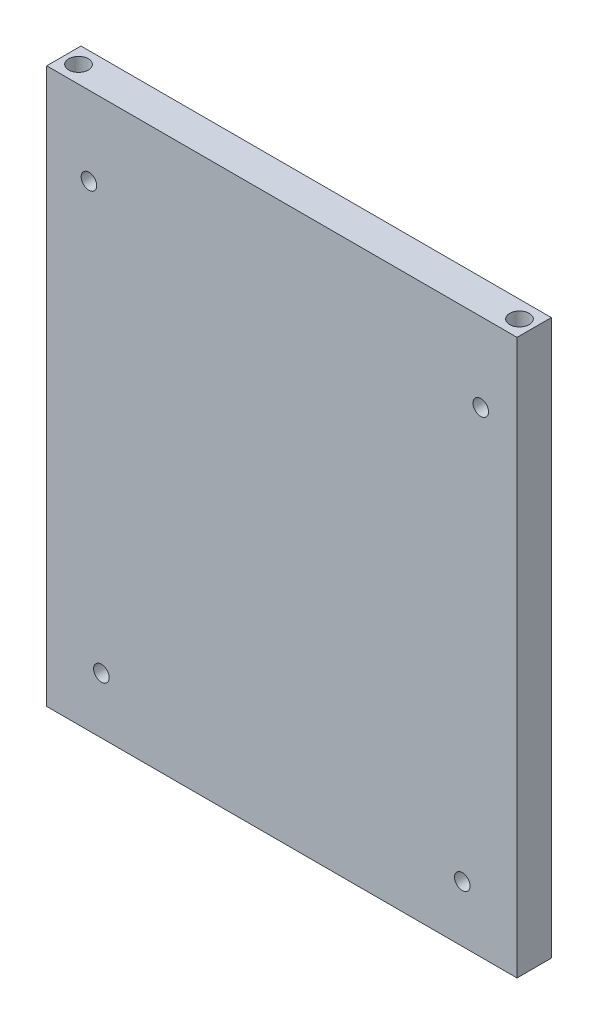
from build123d import *

# Parameters (mm, degrees)
SKETCH1_W           = 96
SKETCH1_H           = 113.24
BOSS_EXTRUDE1_DEPTH = 7
SKETCH2_R           = 1.59
CUT_EXTRUDE1_DEPTH  = 10
SKETCH4_R           = 2
CUT_EXTRUDE3_DEPTH  = 197.849722269


with BuildPart() as part:
    # Sketch1 → Boss-Extrude1 (new body)
    with BuildSketch(Plane.XY):
        with Locations((-112.864898463, 42.367863248)):
            Rectangle(SKETCH1_W, SKETCH1_H)
    extrude(amount=BOSS_EXTRUDE1_DEPTH)

    # Sketch2 → Cut-Extrude1 (cut)
    with BuildSketch(Plane.XY.offset(7)):
        with Locations((-152.234898463, 82.899456576)):
            Circle(SKETCH2_R)
        with Locations((-72.264898463, 82.899456576)):
            Circle(SKETCH2_R)
        with Locations((-149.694898463, -2.792907728)):
            Circle(SKETCH2_R)
        with Locations((-76.034898463, -2.792907728)):
            Circle(SKETCH2_R)
    extrude(amount=-CUT_EXTRUDE1_DEPTH, mode=Mode.SUBTRACT)

    # Sketch4 → Cut-Extrude3 (cut, through all)
    with BuildSketch(Plane(origin=(0, 98.987863248, 0), x_dir=(1, 0, 0), z_dir=(0, 1, 0))):
        with Locations(Location((-67.864898463, -3.5, 0), (0, 0, 270))):
            Circle(SKETCH4_R)
        with Locations(Location((-157.864898463, -3.5, 0), (0, 0, 270))):
            Circle(SKETCH4_R)
    extrude(amount=-CUT_EXTRUDE3_DEPTH, mode=Mode.SUBTRACT)


solid = part.part
